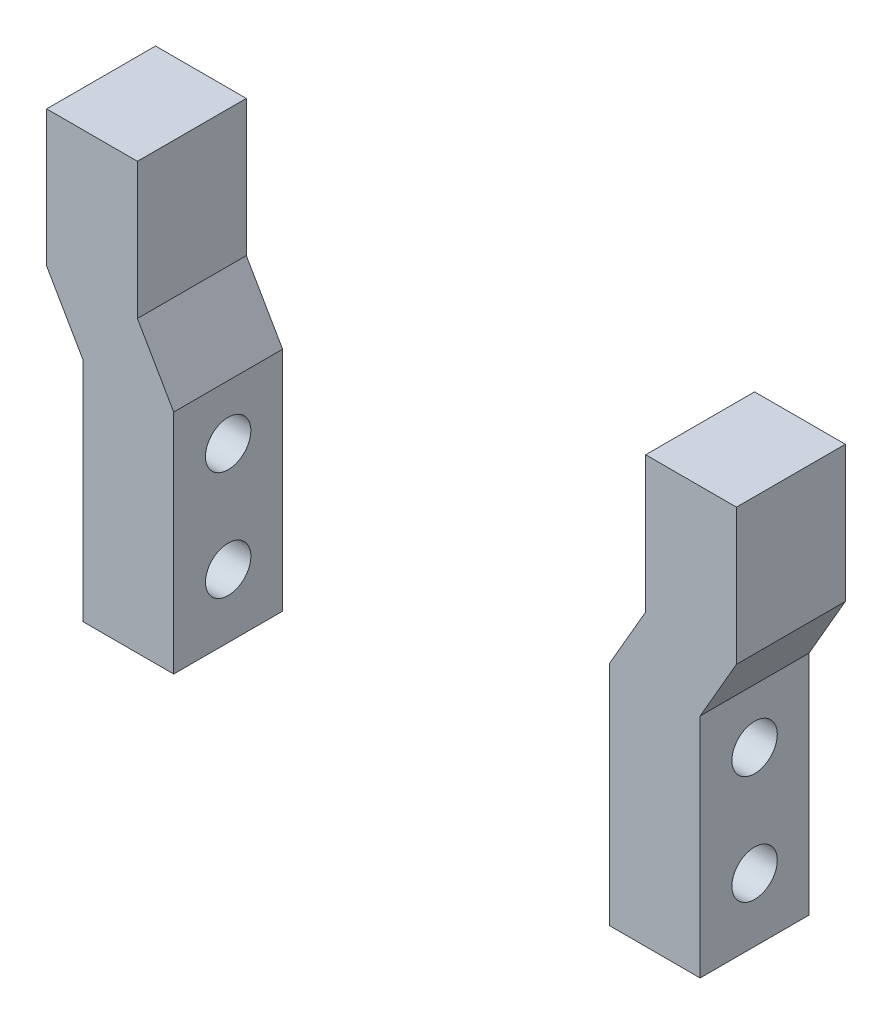
from build123d import *

# Parameters (mm, degrees)
EXTRUDE_1_DEPTH     = 12
EXTRUDE_2_DEPTH     = 12
SKETCH_3_R          = 2.5
CUT_EXTRUDE_1_DEPTH = 10
SKETCH_3_3_R        = 2.5
CUT_EXTRUDE_2_DEPTH = 10
SKETCH_6_R          = 2.5
CUT_EXTRUDE_3_DEPTH = 10


with BuildPart() as part:
    # 草图1 → 凸台-拉伸1 (new body)
    with BuildSketch(Plane.XY):
        Polygon((42.101381637, 34.412975584), (38.101381637, 27.484772353), (38.101381637, 2.484772353), (48.101381637, 2.484772353), (48.101381637, 27.484772353), (52.101381637, 34.412975584), (52.101381637, 49.412975584), (42.101381637, 49.412975584), align=None)
    extrude(amount=EXTRUDE_1_DEPTH)

    # 草图6 → 切除-拉伸3 (cut)
    with BuildSketch(Plane(origin=(48.101381637, 0, 0), x_dir=(0, 0, -1), z_dir=(1, 0, 0))):
        with Locations(Location((-6, 21.484772353, 0), (0, 0, 90))):
            Circle(SKETCH_6_R)
        with Locations(Location((-6, 9.484772353, 0), (0, 0, 90))):
            Circle(SKETCH_6_R)
    extrude(amount=-CUT_EXTRUDE_3_DEPTH, mode=Mode.SUBTRACT)


with BuildPart() as body_2:
    # 草图1<3> → 凸台-拉伸2 (new body)
    with BuildSketch(Plane.XY):
        Polygon((-13.898618363, 34.412975584), (-9.898618363, 27.484772353), (-9.898618363, 2.484772353), (-19.898618363, 2.484772353), (-19.898618363, 27.484772353), (-23.898618363, 34.412975584), (-23.898618363, 49.412975584), (-13.898618363, 49.412975584), align=None)
    extrude(amount=EXTRUDE_2_DEPTH)

    # 草图3 → 切除-拉伸1 (cut)
    with BuildSketch(Plane(origin=(-9.898618363, 0, 0), x_dir=(0, 0, -1), z_dir=(1, 0, 0))):
        with Locations(Location((-6, 21.484772353, 0), (0, 0, 90))):
            Circle(SKETCH_3_R)
    extrude(amount=-CUT_EXTRUDE_1_DEPTH, mode=Mode.SUBTRACT)

    # 草图3<3> → 切除-拉伸2 (cut)
    with BuildSketch(Plane(origin=(-9.898618363, 0, 0), x_dir=(0, 0, -1), z_dir=(1, 0, 0))):
        with Locations(Location((-6, 9.484772353, 0), (0, 0, 90))):
            Circle(SKETCH_3_3_R)
    extrude(amount=-CUT_EXTRUDE_2_DEPTH, mode=Mode.SUBTRACT)


solid = Compound([part.part, body_2.part])
